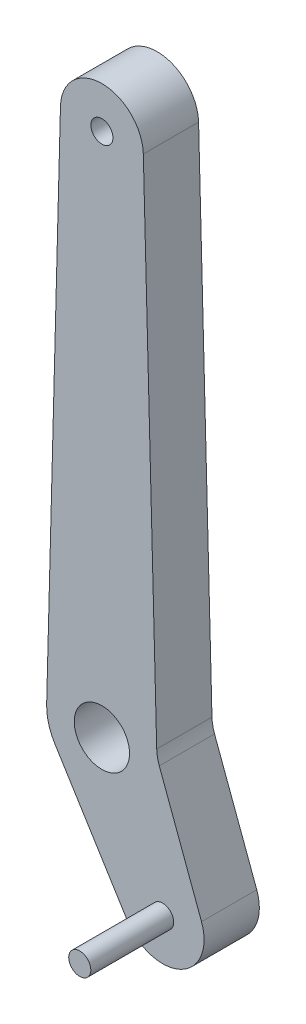
from build123d import *

# Parameters (mm, degrees)
SKETCH_1_R      = 4
SKETCH_1_R_2    = 10
EXTRUDE_1_DEPTH = 20
SKETCH_2_R      = 4
EXTRUDE_2_DEPTH = 30


with BuildPart() as part:
    # 草图1 → 凸台-拉伸1 (new body)
    with BuildSketch(Plane.XY):
        with BuildLine():
            Line((-14.994805195, 190.394736842), (-19.993073593, 0.526315789))
            ThreePointArc((-19.993073593, 0.526315789), (-19.303930684, -5.230512418), (-16.992485973, -10.547768506))
            Line((-16.992485973, -10.547768506), (9.244756909, -52.816043677))
            ThreePointArc((9.244756909, -52.816043677), (28.585857805, -58.376782487), (36.052833152, -39.688703956))
            Line((36.052833152, -39.688703956), (20.771333694, 1.510194546))
            ThreePointArc((20.771333694, 1.510194546), (20.107121839, 3.882720212), (19.840240262, 6.331971045))
            Line((19.840240262, 6.331971045), (14.994805195, 190.394736842))
            ThreePointArc((14.994805195, 190.394736842), (0, 205), (-14.994805195, 190.394736842))
        make_face()
        with Locations((0, 190)):
            Circle(SKETCH_1_R, mode=Mode.SUBTRACT)
        Circle(SKETCH_1_R_2, mode=Mode.SUBTRACT)
    extrude(amount=EXTRUDE_1_DEPTH)

    # 草图2 → 凸台-拉伸2 (add)
    with BuildSketch(Plane.XY.offset(20)):
        with Locations(Location((21.989121389, -44.905217298, 0), (0, 0, 180))):
            Circle(SKETCH_2_R)
    extrude(amount=EXTRUDE_2_DEPTH)


solid = part.part
